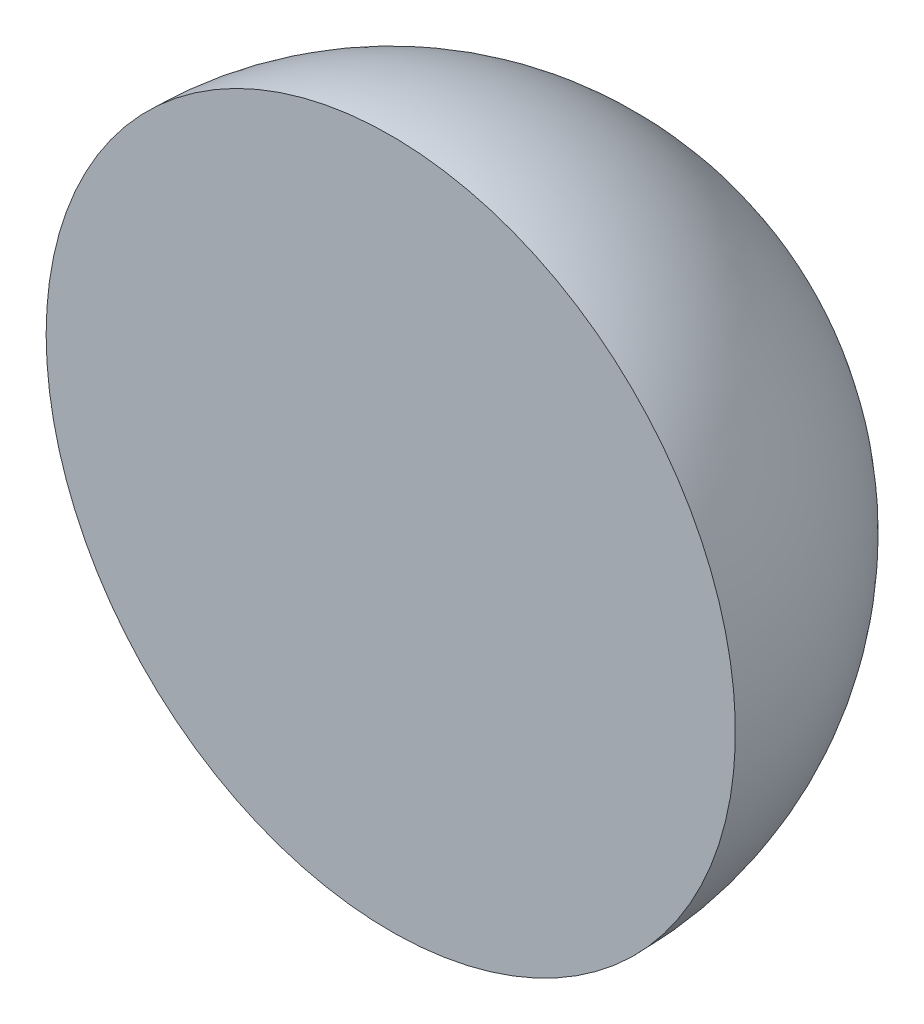
from build123d import *

# Parameters (mm, degrees)
REVOLVE3_ANGLE = 180


with BuildPart() as part:
    # Sketch2 → Revolve3 (revolve)
    with BuildSketch(Plane.XY):
        with BuildLine():
            Line((26.954984255, -14.620818154), (26.954984255, 35.379181846))
            ThreePointArc((26.954984255, 35.379181846), (1.954984255, 10.379181846), (26.954984255, -14.620818154))
        make_face()
    revolve(axis=Axis((26.954984255, 42.919319527, 0), (0, -1, 0)), revolution_arc=REVOLVE3_ANGLE)


solid = part.part
